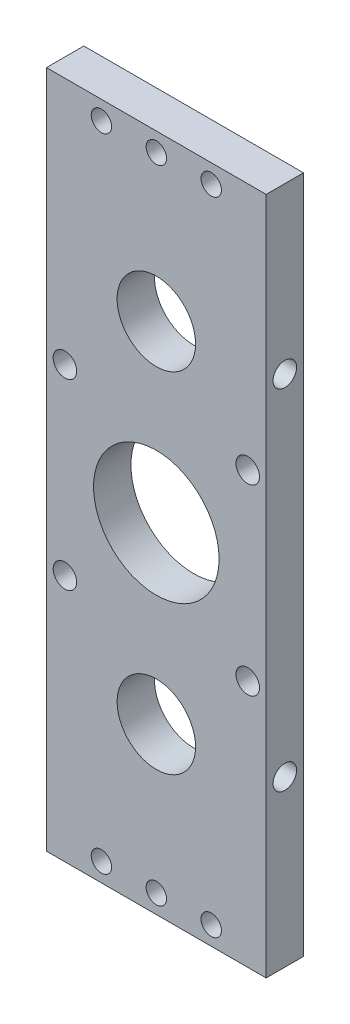
from build123d import *

# Parameters (mm, degrees)
ESBO_O1_W                = 56
ESBO_O1_H                = 173
RESSALTO_EXTRUS_O1_DEPTH = 9.525
ESBO_O2_R                = 16
ESBO_O2_R_2              = 10
ESBO_O2_R_3              = 3
ESBO_O2_R_4              = 2.6
CORTE_EXTRUS_O1_DEPTH    = 9.525
CORTAR_EXTRUIR1_REACH    = 105.484
CROQUIS1_R               = 2
CROQUIS2_R               = 3
CORTAR_EXTRUIR2_DEPTH    = 7


with BuildPart() as part:
    # Esboço1 → Ressalto-extrusão1 (new body)
    with BuildSketch(Plane.XY):
        Rectangle(ESBO_O1_W, ESBO_O1_H)
    extrude(amount=RESSALTO_EXTRUS_O1_DEPTH)

    # Esboço2 → Corte-extrusão1 (cut)
    with BuildSketch(Plane.XY.offset(9.525)):
        Circle(ESBO_O2_R)
        with Locations((0, 44.47)):
            Circle(ESBO_O2_R_2)
        with Locations((0, -44.47)):
            Circle(ESBO_O2_R_2)
        with Locations((23.3, 23.3)):
            Circle(ESBO_O2_R_3)
        with Locations((23.3, -23.3)):
            Circle(ESBO_O2_R_3)
        with Locations((-23.3, -23.3)):
            Circle(ESBO_O2_R_3)
        with Locations((-23.3, 23.3)):
            Circle(ESBO_O2_R_3)
        with Locations((0, 81.74)):
            Circle(ESBO_O2_R_4)
        with Locations((14, 81.74)):
            Circle(ESBO_O2_R_4)
        with Locations((-14, 81.74)):
            Circle(ESBO_O2_R_4)
        with Locations((14, -81.74)):
            Circle(ESBO_O2_R_4)
        with Locations((0, -81.74)):
            Circle(ESBO_O2_R_4)
        with Locations((-14, -81.74)):
            Circle(ESBO_O2_R_4)
    extrude(amount=-CORTE_EXTRUS_O1_DEPTH, mode=Mode.SUBTRACT)

    # Croquis1 → Cortar-Extruir1 (cut, up to next)
    with BuildSketch(Plane(origin=(28, 0, 0), x_dir=(0, 0, -1), z_dir=(1, 0, 0)), mode=Mode.PRIVATE) as cortar_extruir1_sk1:
        with Locations(Location((-4.7625, 44.47, 0), (0, 0, 90))):
            Circle(CROQUIS1_R)
    cortar_extruir1_tool1 = extrude(cortar_extruir1_sk1.sketch, amount=-CORTAR_EXTRUIR1_REACH, mode=Mode.PRIVATE) & part.part
    # Croquis1 → Cortar-Extruir1 (cut, up to next)
    with BuildSketch(Plane(origin=(28, 0, 0), x_dir=(0, 0, -1), z_dir=(1, 0, 0)), mode=Mode.PRIVATE) as cortar_extruir1_sk2:
        with Locations(Location((-4.7625, -44.47, 0), (0, 0, 90))):
            Circle(CROQUIS1_R)
    cortar_extruir1_tool2 = extrude(cortar_extruir1_sk2.sketch, amount=-CORTAR_EXTRUIR1_REACH, mode=Mode.PRIVATE) & part.part
    add(cortar_extruir1_tool1.solids().sort_by_distance((28, 44.47, 4.7625))[0], mode=Mode.SUBTRACT)
    add(cortar_extruir1_tool2.solids().sort_by_distance((28, -44.47, 4.7625))[0], mode=Mode.SUBTRACT)

    # Croquis2 → Cortar-Extruir2 (cut)
    with BuildSketch(Plane(origin=(28, 0, 0), x_dir=(0, 0, -1), z_dir=(1, 0, 0))):
        with Locations(Location((-4.7625, 44.47, 0), (0, 0, 90))):
            Circle(CROQUIS2_R)
        with Locations(Location((-4.7625, -44.47, 0), (0, 0, 90))):
            Circle(CROQUIS2_R)
    extrude(amount=-CORTAR_EXTRUIR2_DEPTH, mode=Mode.SUBTRACT)


solid = part.part
